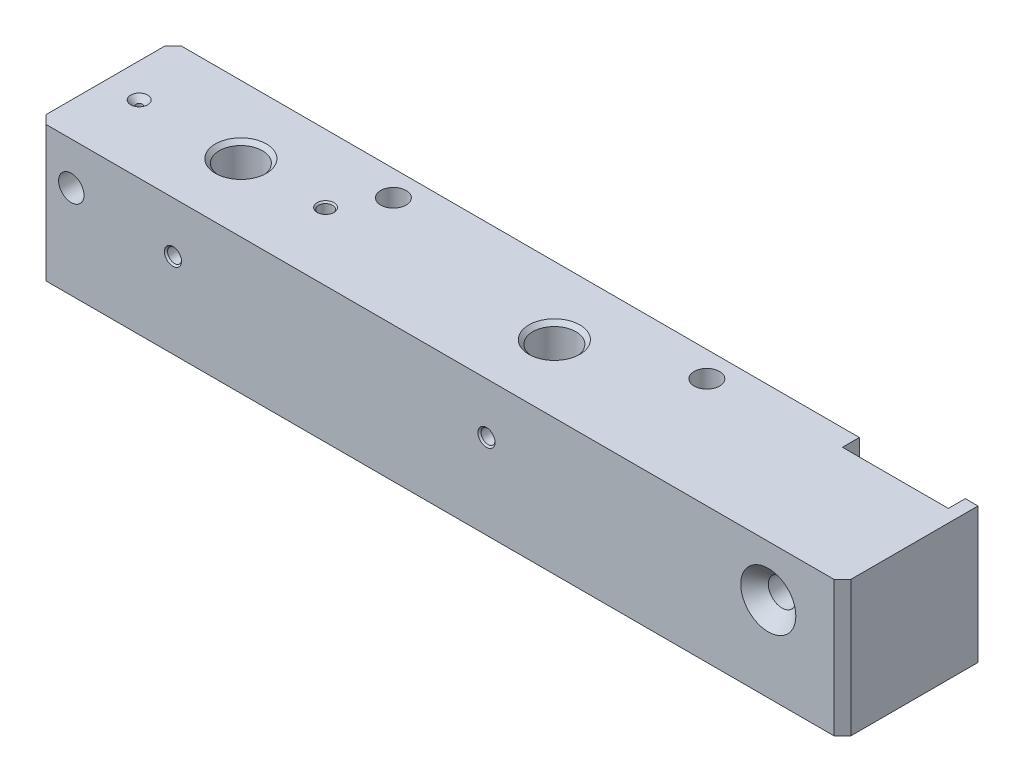
from build123d import *

# Parameters (mm, degrees)
SKETCH2_W                                            = 190
SKETCH2_H                                            = 32
BOSS_EXTRUDE2_DEPTH                                  = 16
CHAMFER1_SIZE                                        = 2
SKETCH3_W                                            = 25
SKETCH3_H                                            = 4
CUT_EXTRUDE1_DEPTH                                   = 102.513545894
M12_TAPPED_HOLE1_D                                   = 10.2
M12_TAPPED_HOLE1_DEPTH                               = 24
M12_TAPPED_HOLE1_CSINK_D                             = 12.05
M12_TAPPED_HOLE1_CSINK_ANGLE                         = 90
M12_TAPPED_HOLE1_TIP                                 = 3.064389157
M4_TAPPED_HOLE1_D                                    = 3.3
M4_TAPPED_HOLE1_DEPTH                                = 11.5
M4_TAPPED_HOLE1_CSINK_D                              = 4.05
M4_TAPPED_HOLE1_CSINK_ANGLE                          = 90
M4_TAPPED_HOLE1_TIP                                  = 0.991420021
CSK_FOR_M10_COUNTERSUNK_FLAT_HEAD_SCREW1_D           = 6.5
CSK_FOR_M10_COUNTERSUNK_FLAT_HEAD_SCREW1_CSINK_D     = 13
CSK_FOR_M10_COUNTERSUNK_FLAT_HEAD_SCREW1_CSINK_ANGLE = 90
SKETCH13_R                                           = 3
CUT_EXTRUDE2_DEPTH                                   = 102.513545894
CSK_FOR_M4_COUNTERSUNK_FLAT_HEAD_SCREW1_D            = 1.5
CSK_FOR_M4_COUNTERSUNK_FLAT_HEAD_SCREW1_DEPTH        = 10
CSK_FOR_M4_COUNTERSUNK_FLAT_HEAD_SCREW1_CSINK_D      = 4
CSK_FOR_M4_COUNTERSUNK_FLAT_HEAD_SCREW1_CSINK_ANGLE  = 90
CSK_FOR_M4_COUNTERSUNK_FLAT_HEAD_SCREW1_TIP          = 0.450645464
M4_TAPPED_HOLE2_D                                    = 3.3
M4_TAPPED_HOLE2_DEPTH                                = 16
M4_TAPPED_HOLE2_CSINK_D                              = 4
M4_TAPPED_HOLE2_CSINK_ANGLE                          = 90
M4_TAPPED_HOLE2_TIP                                  = 0.991420021
SKETCH19_R                                           = 3
CUT_EXTRUDE3_DEPTH                                   = 102.51354591


with BuildPart() as part:
    # Sketch2 → Boss-Extrude2 (new, symmetric)
    with BuildSketch(Plane.XY):
        Rectangle(SKETCH2_W, SKETCH2_H)
    extrude(amount=BOSS_EXTRUDE2_DEPTH, both=True)

    # Chamfer1
    chamfer1_edges = [part.edges().sort_by_distance(p)[0] for p in [
        (-95, 0, 16),
        (95, 0, 16),
        (-95, 0, -16),
    ]]
    chamfer(chamfer1_edges, length=CHAMFER1_SIZE)

    # Sketch3 → Cut-Extrude1 (cut, through all)
    with BuildSketch(Plane(origin=(0, 16, 0), x_dir=(1, 0, 0), z_dir=(0, 1, 0))):
        with Locations((79.5, 14)):
            Rectangle(SKETCH3_W, SKETCH3_H)
    extrude(amount=-CUT_EXTRUDE1_DEPTH, mode=Mode.SUBTRACT)

    # M12 Tapped Hole1
    with Locations(Plane(origin=(0, 16, 0), x_dir=(1, 0, 0), z_dir=(0, 1, 0))):
        with Locations((-63, 0), (11, 0)):
            CounterSinkHole(M12_TAPPED_HOLE1_D / 2, M12_TAPPED_HOLE1_CSINK_D / 2, depth=M12_TAPPED_HOLE1_DEPTH, counter_sink_angle=M12_TAPPED_HOLE1_CSINK_ANGLE)
            with Locations((0, 0, -(M12_TAPPED_HOLE1_DEPTH + M12_TAPPED_HOLE1_TIP / 2))):  # 118° drill point
                Cone(0, M12_TAPPED_HOLE1_D / 2, M12_TAPPED_HOLE1_TIP, mode=Mode.SUBTRACT)

    # M4 Tapped Hole1
    with Locations(Plane.XY.offset(16)):
        with Locations((-63.030813748, 4), (10.974374685, 4)):
            CounterSinkHole(M4_TAPPED_HOLE1_D / 2, M4_TAPPED_HOLE1_CSINK_D / 2, depth=M4_TAPPED_HOLE1_DEPTH, counter_sink_angle=M4_TAPPED_HOLE1_CSINK_ANGLE)
            with Locations((0, 0, -(M4_TAPPED_HOLE1_DEPTH + M4_TAPPED_HOLE1_TIP / 2))):  # 118° drill point
                Cone(0, M4_TAPPED_HOLE1_D / 2, M4_TAPPED_HOLE1_TIP, mode=Mode.SUBTRACT)

    # CSK for M10 Countersunk Flat Head Screw1 (through all)
    with Locations(Plane.XY.offset(16)):
        with Locations((77.5, 4)):
            CounterSinkHole(CSK_FOR_M10_COUNTERSUNK_FLAT_HEAD_SCREW1_D / 2, CSK_FOR_M10_COUNTERSUNK_FLAT_HEAD_SCREW1_CSINK_D / 2, counter_sink_angle=CSK_FOR_M10_COUNTERSUNK_FLAT_HEAD_SCREW1_CSINK_ANGLE)

    # Sketch13 → Cut-Extrude2 (cut, through all)
    with BuildSketch(Plane.XY.offset(16)):
        with Locations((-87.030813748, 6)):
            Circle(SKETCH13_R)
    extrude(amount=-CUT_EXTRUDE2_DEPTH, mode=Mode.SUBTRACT)

    # CSK for M4 Countersunk Flat Head Screw1
    with Locations(Plane(origin=(0, 16, 0), x_dir=(1, 0, 0), z_dir=(0, 1, 0))):
        with Locations((-87, 0)):
            CounterSinkHole(CSK_FOR_M4_COUNTERSUNK_FLAT_HEAD_SCREW1_D / 2, CSK_FOR_M4_COUNTERSUNK_FLAT_HEAD_SCREW1_CSINK_D / 2, depth=CSK_FOR_M4_COUNTERSUNK_FLAT_HEAD_SCREW1_DEPTH, counter_sink_angle=CSK_FOR_M4_COUNTERSUNK_FLAT_HEAD_SCREW1_CSINK_ANGLE)
            with Locations((0, 0, -(CSK_FOR_M4_COUNTERSUNK_FLAT_HEAD_SCREW1_DEPTH + CSK_FOR_M4_COUNTERSUNK_FLAT_HEAD_SCREW1_TIP / 2))):  # 118° drill point
                Cone(0, CSK_FOR_M4_COUNTERSUNK_FLAT_HEAD_SCREW1_D / 2, CSK_FOR_M4_COUNTERSUNK_FLAT_HEAD_SCREW1_TIP, mode=Mode.SUBTRACT)

    # M4 Tapped Hole2
    with Locations(Plane(origin=(0, 16, 0), x_dir=(1, 0, 0), z_dir=(0, 1, 0))):
        with Locations((-43, 0)):
            CounterSinkHole(M4_TAPPED_HOLE2_D / 2, M4_TAPPED_HOLE2_CSINK_D / 2, depth=M4_TAPPED_HOLE2_DEPTH, counter_sink_angle=M4_TAPPED_HOLE2_CSINK_ANGLE)
            with Locations((0, 0, -(M4_TAPPED_HOLE2_DEPTH + M4_TAPPED_HOLE2_TIP / 2))):  # 118° drill point
                Cone(0, M4_TAPPED_HOLE2_D / 2, M4_TAPPED_HOLE2_TIP, mode=Mode.SUBTRACT)

    # Sketch19 → Cut-Extrude3 (cut, through all)
    with BuildSketch(Plane(origin=(0, 16, 0), x_dir=(1, 0, 0), z_dir=(0, 1, 0))):
        with Locations(Location((-37, 10, 0), (0, 0, 270))):
            Circle(SKETCH19_R)
        with Locations(Location((37, 10, 0), (0, 0, 270))):
            Circle(SKETCH19_R)
    extrude(amount=-CUT_EXTRUDE3_DEPTH, mode=Mode.SUBTRACT)


solid = part.part
